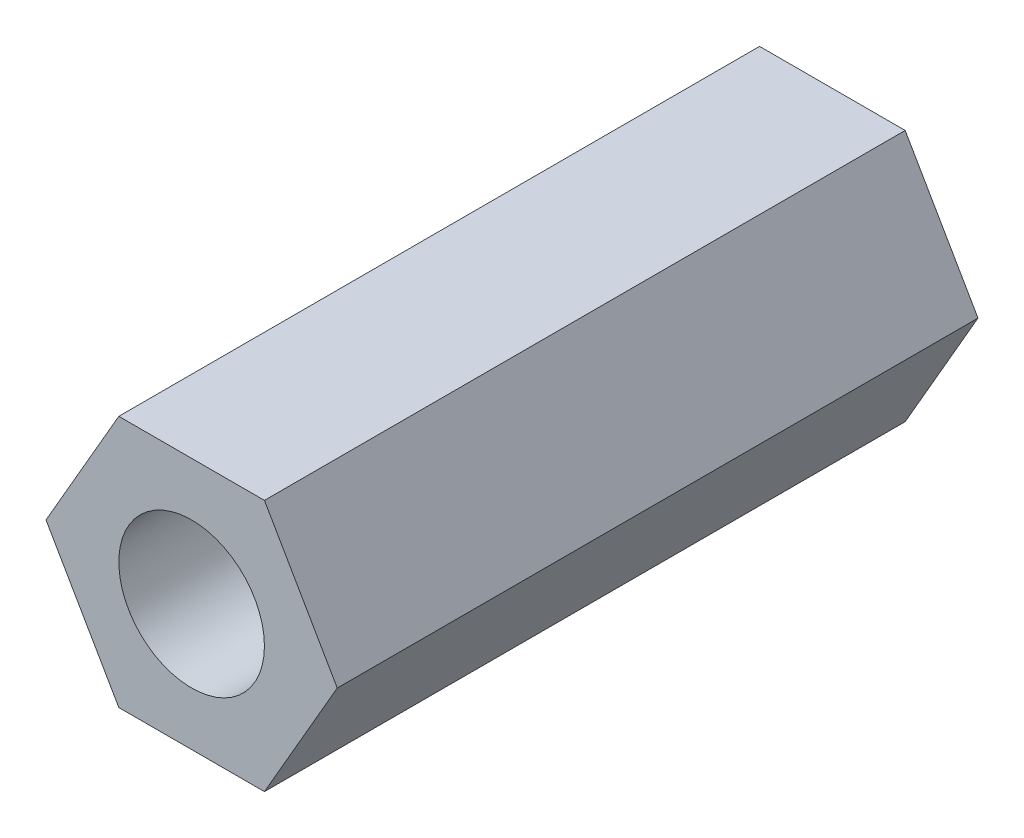
from build123d import *

# Parameters (mm, degrees)
EXTRUDE_1_DEPTH    = 11
HOLE_WIZARD_M3_1_D = 2.5


with BuildPart() as part:
    # 草图1 → 凸台-拉伸1 (new body)
    with BuildSketch(Plane.XY):
        Polygon((0, 0), (2.5, 0), (3.75, -2.165063509), (2.5, -4.330127019), (0, -4.330127019), (-1.25, -2.165063509), align=None)
    extrude(amount=EXTRUDE_1_DEPTH)

    # M3 螺纹孔1 (through all)
    with Locations(Plane.XY.offset(11)):
        with Locations((1.25, -2.165063509)):
            Hole(HOLE_WIZARD_M3_1_D / 2)


solid = part.part
